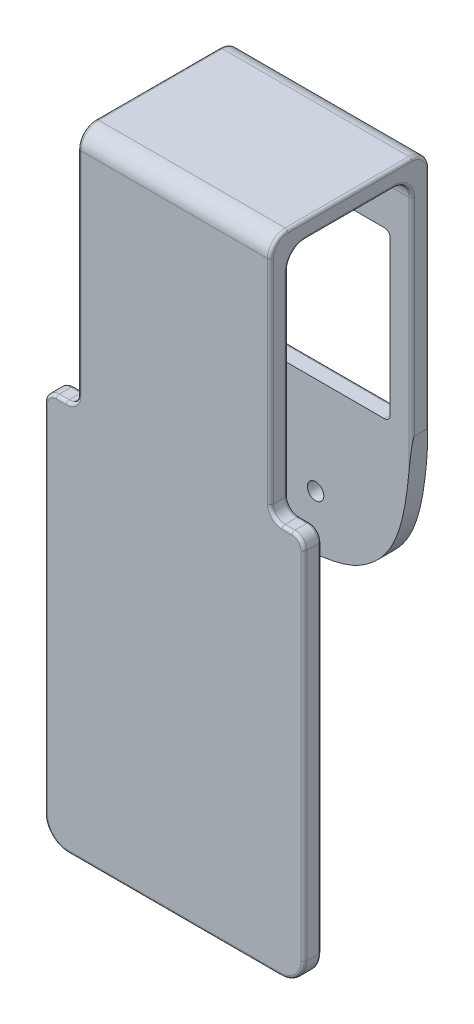
from build123d import *

# Parameters (mm, degrees)
ESQUISSE1_W             = 44
ESQUISSE1_H             = 108
BOSS_EXTRU_1_DEPTH      = 3
CONG_1_R                = 4
ESQUISSE6_W             = 44
ESQUISSE6_H             = 67
BOSS_EXTRU_2_DEPTH      = 3
ENL_V_MAT_EXTRU_1_DEPTH = 3
ESQUISSE7_R             = 1.4
ENL_V_MAT_EXTRU_2_DEPTH = 3
CONG_3_R                = 0.5
BOSS_EXTRU_3_DEPTH      = 44
ESQUISSE10_W            = 11.911631127
ESQUISSE10_H            = 62.018049443
ENL_V_MAT_EXTRU_3_DEPTH = 133.012310032
ENL_V_MAT_EXTRU_4_DEPTH = 3
ESQUISSE12_W            = 27.791788001
ESQUISSE12_H            = 21.034079074
ENL_V_MAT_EXTRU_5_DEPTH = 130.641333574
ESQUISSE13_W            = 27
ESQUISSE13_H            = 3
BOSS_EXTRU_4_DEPTH      = 32.645296423
CONG_4_R                = 3
CONG_5_R                = 2
CONG_6_R                = 0.5
CONG_9_R                = 0.5


with BuildPart() as part:
    # Esquisse1 → Boss.-Extru.1 (new body)
    with BuildSketch(Plane.XY):
        with Locations((22, 54)):
            Rectangle(ESQUISSE1_W, ESQUISSE1_H)
    extrude(amount=BOSS_EXTRU_1_DEPTH)

    # Congé1
    cong_1_edges = [part.edges().sort_by_distance(p)[0] for p in [
        (44, 0, 1.5),
        (0, 0, 1.5),
    ]]
    fillet(cong_1_edges, radius=CONG_1_R)



with BuildPart() as body_2:
    # Esquisse6 → Boss.-Extru.2 (new body)
    with BuildSketch(Plane.XY.offset(-21)):
        with Locations((22, 74.5)):
            Rectangle(ESQUISSE6_W, ESQUISSE6_H)
    extrude(amount=-BOSS_EXTRU_2_DEPTH)

    # Esquisse8 → Enlèv. mat.-Extru.1 (cut)
    with BuildSketch(Plane(origin=(0, 0, -24), x_dir=(-1, 0, 0), z_dir=(0, 0, -1))):
        with BuildLine():
            Line((-33.663140202, 94.833763345), (-9.590037405, 94.833763345))
            ThreePointArc((-9.590037405, 94.833763345), (-8.882930624, 94.540870126), (-8.590037405, 93.833763345))
            Line((-8.590037405, 93.833763345), (-8.590037405, 67.778022742))
            ThreePointArc((-8.590037405, 67.778022742), (-8.882930624, 67.070915961), (-9.590037405, 66.778022742))
            Line((-9.590037405, 66.778022742), (-33.663140202, 66.778022742))
            ThreePointArc((-33.663140202, 66.778022742), (-34.370246983, 67.070915961), (-34.663140202, 67.778022742))
            Line((-34.663140202, 67.778022742), (-34.663140202, 93.833763345))
            ThreePointArc((-34.663140202, 93.833763345), (-34.370246983, 94.540870126), (-33.663140202, 94.833763345))
        make_face()
    extrude(amount=-ENL_V_MAT_EXTRU_1_DEPTH, mode=Mode.SUBTRACT)

    # Esquisse7 → Enlèv. mat.-Extru.2 (cut)
    with BuildSketch(Plane(origin=(0, 0, -24), x_dir=(-1, 0, 0), z_dir=(0, 0, -1))):
        with Locations((-21.993298095, 50.272593118)):
            Circle(ESQUISSE7_R)
    extrude(amount=-ENL_V_MAT_EXTRU_2_DEPTH, mode=Mode.SUBTRACT)

    # Congé3
    cong_3_edges = [body_2.edges().sort_by_distance(p)[0] for p in [
        (34.370246983, 67.070915961, -24),
        (21.626588803, 66.778022742, -24),
        (8.882930624, 67.070915961, -24),
        (8.590037405, 80.805893044, -24),
        (8.882930624, 94.540870126, -24),
        (21.626588803, 94.833763345, -24),
        (34.370246983, 94.540870126, -24),
        (34.663140202, 80.805893044, -24),
    ]]
    fillet(cong_3_edges, radius=CONG_3_R)


with BuildPart() as part_1:
    add(part.part)

    add(body_2.part)  # Boss.-Extru.3 merges body 2
    # Esquisse9 → Boss.-Extru.3 (add)
    with BuildSketch(Plane.ZY):
        with BuildLine():
            Line((-24, 108), (-21, 108))
            ThreePointArc((-21, 108), (-10.5, 118.52950804), (0, 108))
            Line((0, 108), (3, 108))
            ThreePointArc((3, 108), (-10.5, 121.5), (-24, 108))
        make_face()
    extrude(amount=-BOSS_EXTRU_3_DEPTH)

    # Esquisse10 → Enlèv. mat.-Extru.3 (cut, through all)
    with BuildSketch(Plane(origin=(0, 0, -24), x_dir=(-1, 0, 0), z_dir=(0, 0, -1))):
        with Locations((0.278463775, 97.320046546)):
            Rectangle(ESQUISSE10_W, ESQUISSE10_H)
        with Locations((-44.278463774, 97.320046546)):
            Rectangle(ESQUISSE10_W, ESQUISSE10_H)
    extrude(amount=-ENL_V_MAT_EXTRU_3_DEPTH, mode=Mode.SUBTRACT)

    # Esquisse11 → Enlèv. mat.-Extru.4 (cut)
    with BuildSketch(Plane(origin=(0, 0, -24), x_dir=(-1, 0, 0), z_dir=(0, 0, -1))):
        with BuildLine():
            Line((-22.026582868, 41), (-46.960282561, 39.190147629))
            Line((-46.960282561, 39.190147629), (-47.639536728, 67.896019345))
            Line((-47.639536728, 67.896019345), (-38.322648211, 66.311021824))
            add(Edge.make_bspline(
                [(-38.322648211, 66.311021824), (-38.022294445, 63.365247316), (-37.625626057, 56.5896954), (-35.415865813, 47.655918994), (-29.37943083, 42.619185596), (-25.670476457, 41.534371038), (-22.026582868, 41)],
                knots=[0, 0, 0, 0, 0.286645507, 0.640363628, 0.826200773, 1, 1, 1, 1], degree=3))
        make_face()
        with BuildLine():
            Line((3.583226076, 67.946047322), (-5.730548614, 66.342853704))
            add(Edge.make_bspline(
                [(-5.730548614, 66.342853704), (-6.025147686, 63.39649812), (-6.40858031, 56.620184299), (-8.600885567, 47.682108507), (-14.627470543, 42.633593462), (-18.334298821, 41.541536097), (-21.977141646, 41.000048288)],
                knots=[0, 0, 0, 0, 0.286645507, 0.640363628, 0.826200773, 1, 1, 1, 1], degree=3))
            Line((-21.977141646, 41.000048288), (2.96004575, 39.238903551))
            Line((2.96004575, 39.238903551), (3.583226076, 67.946047322))
        make_face()
    extrude(amount=-ENL_V_MAT_EXTRU_4_DEPTH, mode=Mode.SUBTRACT)

    # Esquisse12 → Enlèv. mat.-Extru.5 (cut, through all)
    with BuildSketch(Plane.ZY.offset(-5.677351789)):
        with Locations((-10.104105999, 114.910725646)):
            Rectangle(ESQUISSE12_W, ESQUISSE12_H)
    extrude(amount=-ENL_V_MAT_EXTRU_5_DEPTH, mode=Mode.SUBTRACT)


with BuildPart() as enl_v_mat_extru_5_piece_1:
    # of the separate pieces the step leaves, piece 1, a body of its own (enl_v_mat_extru_5_pieces)
    add(part_1.part.solids().sort_by_distance((38.322648211, 104.393686109, 3))[0])



with BuildPart() as enl_v_mat_extru_5_piece_2:
    # of the separate pieces the step leaves, piece 2, a body of its own (enl_v_mat_extru_5_pieces)
    add(part_1.part.solids().sort_by_distance((5.677351789, 66.352010551, -24))[0])


with BuildPart() as enl_v_mat_extru_5_piece_1_1:
    add(enl_v_mat_extru_5_piece_1.part)

    add(enl_v_mat_extru_5_piece_2.part)  # Boss.-Extru.4 merges Enlèv. mat.-Extru.5 piece 2
    # Esquisse13 → Boss.-Extru.4 (add)
    with BuildSketch(Plane.ZY.offset(-5.677351789)):
        with Locations((-10.5, 105.893686109)):
            Rectangle(ESQUISSE13_W, ESQUISSE13_H)
    extrude(amount=-BOSS_EXTRU_4_DEPTH)

    # Congé4
    cong_4_edges = [enl_v_mat_extru_5_piece_1_1.edges().sort_by_distance(p)[0] for p in [
        (22, 107.393686109, -24),
        (22, 107.393686109, 3),
        (22, 104.393686109, -21),
        (22, 104.393686109, 0),
    ]]
    fillet(cong_4_edges, radius=CONG_4_R)

    # Congé5
    cong_5_edges = [enl_v_mat_extru_5_piece_1_1.edges().sort_by_distance(p)[0] for p in [
        (0, 66.311021824, 1.5),
        (44, 66.311021824, 1.5),
        (38.322648211, 66.311021824, 1.5),
        (5.677351789, 66.311021824, 1.5),
    ]]
    fillet(cong_5_edges, radius=CONG_5_R)

    # Congé6
    cong_6_edges = [enl_v_mat_extru_5_piece_1_1.edges().sort_by_distance(p)[0] for p in [
        (5.677351789, 85.37284833, -24),
        (5.677351789, 106.515006452, -23.121320344),
        (38.322648212, 107.393686109, -10.5),
        (5.677351789, 107.393686109, -10.5),
        (5.677351789, 106.515006452, 2.121320344),
        (5.677351789, 86.352353966, 3),
        (5.091565351, 66.896808262, 3),
        (2.838675894, 66.311021824, 3),
        (0.585786438, 65.725235386, 3),
        (0, 34.155510912, 3),
        (1.171572875, 1.171572875, 3),
        (22, 0, 3),
        (42.828427125, 1.171572875, 3),
        (44, 34.155510912, 3),
        (43.414213562, 65.725235386, 3),
        (41.161324106, 66.311021824, 3),
        (38.908434649, 66.896808262, 3),
        (38.322648211, 86.352353966, 3),
        (38.322648211, 106.515006452, 2.121320344),
        (38.322648211, 106.515006452, -23.121320344),
        (38.322648211, 85.352353966, -24),
    ]]
    fillet(cong_6_edges, radius=CONG_6_R)

    # Congé9
    cong_9_edges = [enl_v_mat_extru_5_piece_1_1.edges().sort_by_distance(p)[0] for p in [
        (38.322648211, 83.852353966, -21),
        (38.322648211, 103.515006452, -20.121320344),
        (38.322648212, 104.393686109, -10.5),
        (5.677351789, 104.393686109, -10.5),
        (38.322648211, 103.515006452, -0.878679656),
        (38.322648211, 84.852353966, 0),
        (5.677351789, 83.87284833, -21),
        (5.677351789, 103.515006452, -20.121320344),
        (5.677351789, 103.515006452, -0.878679656),
        (5.677351789, 84.852353966, 0),
        (5.091565351, 66.896808262, 0),
        (2.838675894, 66.311021824, 0),
        (0.585786438, 65.725235386, 0),
        (0, 34.155510912, 0),
        (1.171572875, 1.171572875, 0),
        (22, 0, 0),
        (42.828427125, 1.171572875, 0),
        (44, 34.155510912, 0),
        (43.414213562, 65.725235386, 0),
        (41.161324106, 66.311021824, 0),
        (38.908434649, 66.896808262, 0),
    ]]
    fillet(cong_9_edges, radius=CONG_9_R)


solid = enl_v_mat_extru_5_piece_1_1.part
